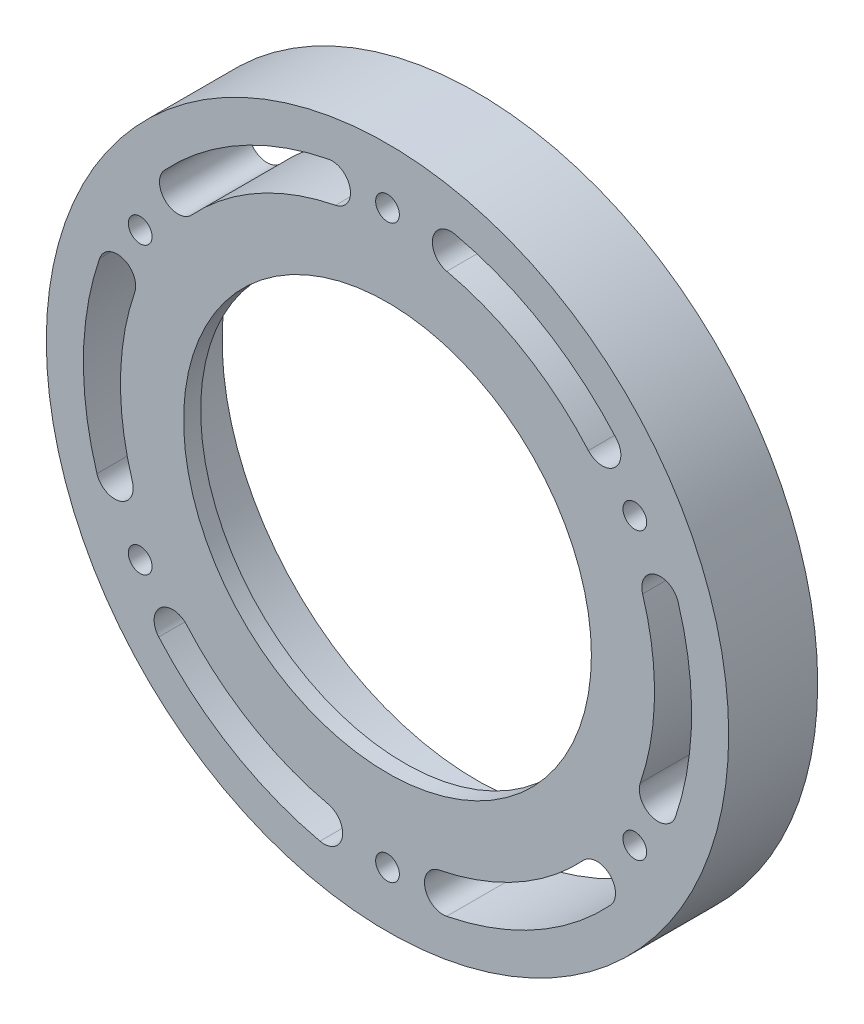
from build123d import *

# Parameters (mm, degrees)
SKETCH_1_R      = 46
SKETCH_1_R_2    = 34.3
SKETCH_1_R_3    = 1.6
EXTRUDE_1_DEPTH = 12
EXTRUDE_START   = -2.3
SKETCH_4_R      = 34.3
SKETCH_4_R_2    = 27.488330285
EXTRUDE_2_DEPTH = 2.3


with BuildPart() as part:
    # 草图1 → 凸台-拉伸1 (new body)
    with BuildSketch(Plane.XY):
        Circle(SKETCH_1_R)
        Circle(SKETCH_1_R_2, mode=Mode.SUBTRACT)
        with Locations((0, 38.5)):
            Circle(SKETCH_1_R_3, mode=Mode.SUBTRACT)
        with Locations((33.341978046, 19.25)):
            Circle(SKETCH_1_R_3, mode=Mode.SUBTRACT)
        with Locations((33.341978046, -19.25)):
            Circle(SKETCH_1_R_3, mode=Mode.SUBTRACT)
        with Locations((0, -38.5)):
            Circle(SKETCH_1_R_3, mode=Mode.SUBTRACT)
        with Locations((-33.341978046, -19.25)):
            Circle(SKETCH_1_R_3, mode=Mode.SUBTRACT)
        with Locations((-33.341978046, 19.25)):
            Circle(SKETCH_1_R_3, mode=Mode.SUBTRACT)
        with BuildLine():
            ThreePointArc((-7.974877173, 40.216928452), (-19.999395147, 35.791398321), (-30.070678328, 27.87031225))
            ThreePointArc((-30.070678328, 27.87031225), (-29.936509665, 24.337325019), (-26.403522434, 24.471493683))
            ThreePointArc((-26.403522434, 24.471493683), (-17.56044452, 31.426593647), (-7.002331176, 35.312424982))
            ThreePointArc((-7.002331176, 35.312424982), (-5.03635244, 38.250949715), (-7.974877173, 40.216928452))
        make_face(mode=Mode.SUBTRACT)
        with BuildLine():
            ThreePointArc((30.841443115, 27.01491045), (20.996562609, 35.215683418), (9.101059256, 39.977127466))
            ThreePointArc((9.101059256, 39.977127466), (6.108486895, 38.09444038), (7.991173981, 35.101868019))
            ThreePointArc((7.991173981, 35.101868019), (18.436006193, 30.921087879), (27.080291515, 23.720409175))
            ThreePointArc((27.080291515, 23.720409175), (30.608117952, 23.487084013), (30.841443115, 27.01491045))
        make_face(mode=Mode.SUBTRACT)
        with BuildLine():
            ThreePointArc((38.816320288, -13.202018002), (40.995957756, -0.575714903), (39.171737584, 12.106815216))
            ThreePointArc((39.171737584, 12.106815216), (36.044996559, 13.757115361), (34.394696415, 10.630374336))
            ThreePointArc((34.394696415, 10.630374336), (35.996450713, -0.505505768), (34.082622692, -11.592015806))
            ThreePointArc((34.082622692, -11.592015806), (35.644470392, -14.763865702), (38.816320288, -13.202018002))
        make_face(mode=Mode.SUBTRACT)
        with BuildLine():
            ThreePointArc((7.974877173, -40.216928452), (19.999395147, -35.791398321), (30.070678328, -27.87031225))
            ThreePointArc((30.070678328, -27.87031225), (29.936509665, -24.337325019), (26.403522434, -24.471493683))
            ThreePointArc((26.403522434, -24.471493683), (17.56044452, -31.426593647), (7.002331176, -35.312424982))
            ThreePointArc((7.002331176, -35.312424982), (5.03635244, -38.250949715), (7.974877173, -40.216928452))
        make_face(mode=Mode.SUBTRACT)
        with BuildLine():
            ThreePointArc((-30.841443115, -27.01491045), (-20.996562609, -35.215683418), (-9.101059256, -39.977127466))
            ThreePointArc((-9.101059256, -39.977127466), (-6.108486895, -38.09444038), (-7.991173981, -35.101868019))
            ThreePointArc((-7.991173981, -35.101868019), (-18.436006193, -30.921087879), (-27.080291515, -23.720409175))
            ThreePointArc((-27.080291515, -23.720409175), (-30.608117952, -23.487084013), (-30.841443115, -27.01491045))
        make_face(mode=Mode.SUBTRACT)
        with BuildLine():
            ThreePointArc((-38.816320288, 13.202018002), (-40.995957756, 0.575714903), (-39.171737584, -12.106815216))
            ThreePointArc((-39.171737584, -12.106815216), (-36.044996559, -13.757115361), (-34.394696415, -10.630374336))
            ThreePointArc((-34.394696415, -10.630374336), (-35.996450713, 0.505505768), (-34.082622692, 11.592015806))
            ThreePointArc((-34.082622692, 11.592015806), (-35.644470392, 14.763865702), (-38.816320288, 13.202018002))
        make_face(mode=Mode.SUBTRACT)
    extrude(amount=EXTRUDE_1_DEPTH)

    # 草图4 → 凸台-拉伸2 (add)
    with BuildSketch(Plane.XY.offset(12).offset(EXTRUDE_START)):
        Circle(SKETCH_4_R)
        Circle(SKETCH_4_R_2, mode=Mode.SUBTRACT)
    extrude(amount=EXTRUDE_2_DEPTH)


solid = part.part
